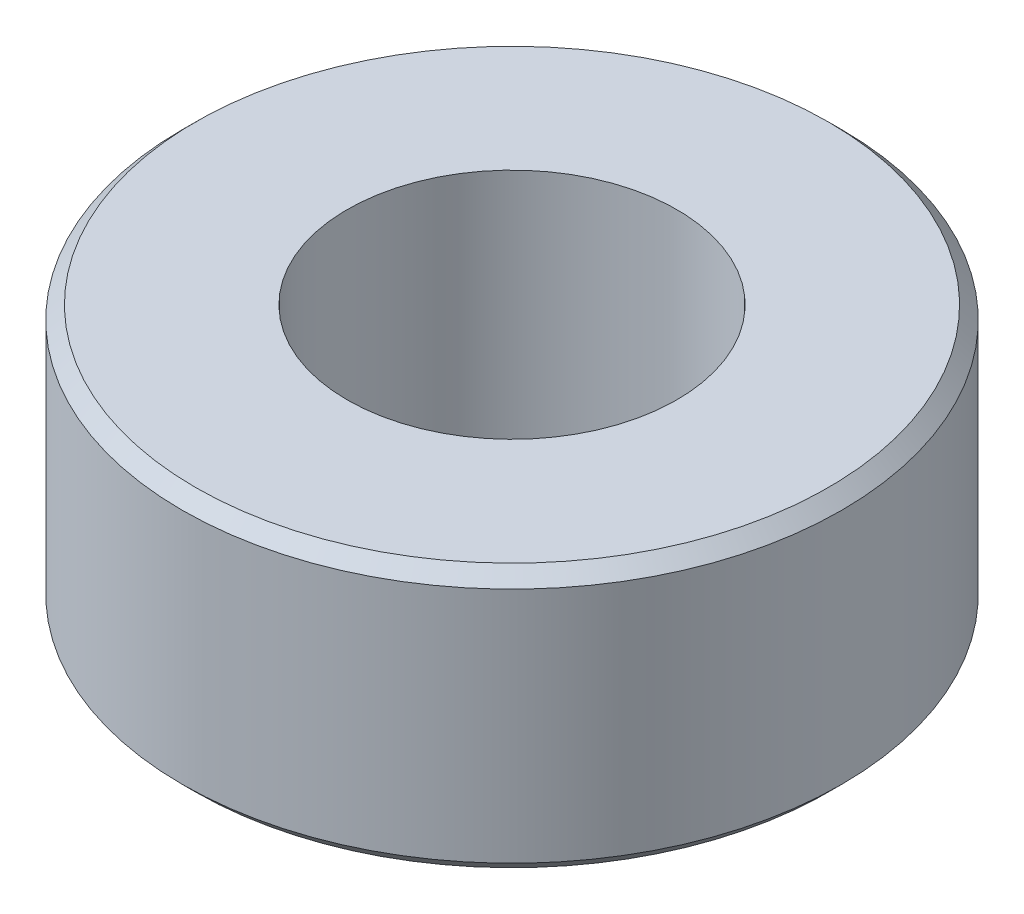
from build123d import *

# Parameters (mm, degrees)
SKETCH_1_R      = 5
SKETCH_1_R_2    = 2.5
EXTRUDE_1_DEPTH = 4
CHAMFER_1_SIZE  = 0.2


with BuildPart() as part:
    # 草图1 → 凸台-拉伸1 (new body)
    with BuildSketch(Plane(origin=(0, 0, 0), x_dir=(1, 0, 0), z_dir=(0, 1, 0))):
        with Locations(Location((0, 0, 0), (0, 0, 270))):
            Circle(SKETCH_1_R)
        with Locations(Location((0, 0, 0), (0, 0, 270))):
            Circle(SKETCH_1_R_2, mode=Mode.SUBTRACT)
    extrude(amount=EXTRUDE_1_DEPTH)

    # 倒角1
    chamfer_1_edges = [part.edges().sort_by_distance(p)[0] for p in [
        (0, 0, -5),
        (0, 4, -5),
    ]]
    chamfer(chamfer_1_edges, length=CHAMFER_1_SIZE)


solid = part.part
